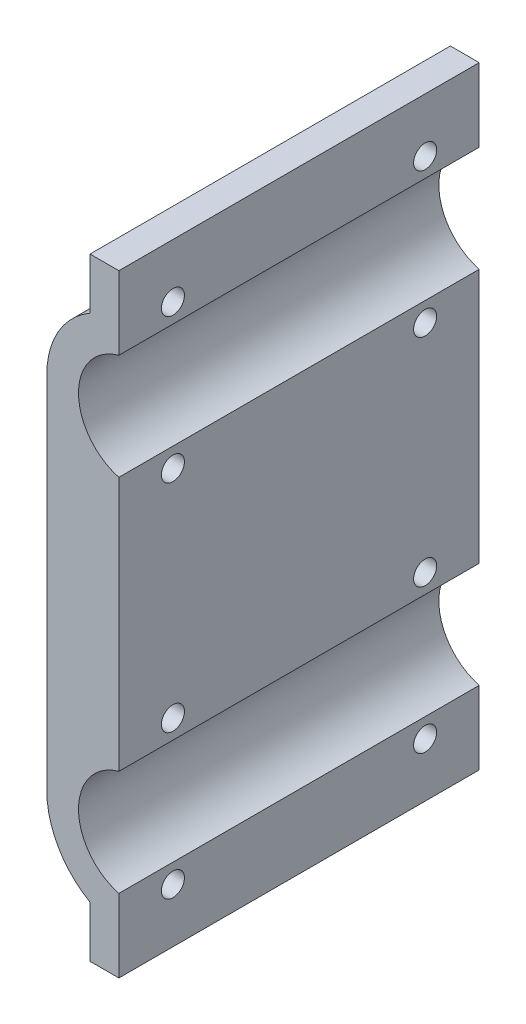
from build123d import *

# Parameters (mm, degrees)
RESSALTO_EXTRUS_O1_DEPTH        = 50
ESBO_O2_R                       = 1.6
CORTE_EXTRUS_O1_DEPTH           = 67.379590237
CORTE_EXTRUS_O2_DEPTH           = 6
CORTE_EXTRUS_O2_DRAFT           = -2
CORTE_EXTRUS_O2_PROFILE_2_DEPTH = 6
CORTE_EXTRUS_O2_PROFILE_2_DRAFT = -2
CORTE_EXTRUS_O2_PROFILE_3_DEPTH = 6
CORTE_EXTRUS_O2_PROFILE_3_DRAFT = -2
CORTE_EXTRUS_O2_PROFILE_4_DEPTH = 6
CORTE_EXTRUS_O2_PROFILE_4_DRAFT = -2
CORTE_EXTRUS_O2_PROFILE_5_DEPTH = 6
CORTE_EXTRUS_O2_PROFILE_5_DRAFT = -2
CORTE_EXTRUS_O2_PROFILE_6_DEPTH = 6
CORTE_EXTRUS_O2_PROFILE_6_DRAFT = -2
CORTE_EXTRUS_O2_PROFILE_7_DEPTH = 6
CORTE_EXTRUS_O2_PROFILE_7_DRAFT = -2
CORTE_EXTRUS_O2_PROFILE_8_DEPTH = 6
CORTE_EXTRUS_O2_PROFILE_8_DRAFT = -2


with BuildPart() as part:
    # Esboço1 → Ressalto-extrusão1 (new body)
    with BuildSketch(Plane.XY):
        with BuildLine():
            Line((0, 17.667878888), (0, -17.667878888))
            ThreePointArc((0, -17.667878888), (-5.6, -25), (0, -32.332121112))
            Line((0, -32.332121112), (0, -42.5))
            Line((0, -42.5), (-4, -42.5))
            Line((-4, -42.5), (-4, -35.392304845))
            ThreePointArc((-4, -35.392304845), (-8.392304845, -31), (-10, -25))
            Line((-10, -25), (-10, 25))
            ThreePointArc((-10, 25), (-8.392304845, 31), (-4, 35.392304845))
            Line((-4, 35.392304845), (-4, 42.5))
            Line((-4, 42.5), (0, 42.5))
            Line((0, 42.5), (0, 32.332121112))
            ThreePointArc((0, 32.332121112), (-5.6, 25), (0, 17.667878888))
        make_face()
    extrude(amount=RESSALTO_EXTRUS_O1_DEPTH)

    # Esboço2 → Corte-extrusão1 (cut, through all)
    with BuildSketch(Plane(origin=(0, 0, 0), x_dir=(0, 0, -1), z_dir=(1, 0, 0))):
        with Locations(Location((-42.5, 35, 0), (0, 0, 90))):
            Circle(ESBO_O2_R)
        with Locations(Location((-7.5, 35, 0), (0, 0, 90))):
            Circle(ESBO_O2_R)
        with Locations(Location((-7.5, -35, 0), (0, 0, 90))):
            Circle(ESBO_O2_R)
        with Locations(Location((-42.5, -35, 0), (0, 0, 90))):
            Circle(ESBO_O2_R)
        with Locations(Location((-42.5, -15, 0), (0, 0, 90))):
            Circle(ESBO_O2_R)
        with Locations(Location((-42.5, 15, 0), (0, 0, 90))):
            Circle(ESBO_O2_R)
        with Locations(Location((-7.5, 15, 0), (0, 0, 90))):
            Circle(ESBO_O2_R)
        with Locations(Location((-7.5, -15, 0), (0, 0, 90))):
            Circle(ESBO_O2_R)
    extrude(amount=-CORTE_EXTRUS_O1_DEPTH, mode=Mode.SUBTRACT)


with BuildPart() as corte_extrus_o2_tool:
    # Esboço3 → Corte-extrusão2 (with draft: the straight prism first)
    with BuildSketch(Plane.ZY.offset(10)):
        Polygon((10.25, 36.58771324), (7.5, 38.175426481), (4.75, 36.58771324), (4.75, 33.41228676), (7.5, 31.824573519), (10.25, 33.41228676), align=None)
    extrude(amount=-CORTE_EXTRUS_O2_DEPTH)
    # Corte-extrusão2: the draft: its side faces are tilted about the plane it starts from
    corte_extrus_o2_sides = [corte_extrus_o2_tool.faces().sort_by_distance(p)[0] for p in [
        (-7, 37.38156986, 8.875),
        (-7, 37.38156986, 6.125),
        (-7, 35, 4.75),
        (-7, 32.61843014, 6.125),
        (-7, 32.61843014, 8.875),
        (-7, 35, 10.25),
    ]]
    draft(corte_extrus_o2_sides, Plane.ZY.offset(10), CORTE_EXTRUS_O2_DRAFT)


with BuildPart() as part_1:
    add(part.part)

    # Corte-extrusão2: cut by corte_extrus_o2_tool
    add(corte_extrus_o2_tool.part, mode=Mode.SUBTRACT)


with BuildPart() as corte_extrus_o2_profile_2_tool:
    # Esboço3 → Corte-extrusão2 profile 2 (with draft: the straight prism first)
    with BuildSketch(Plane.ZY.offset(10)):
        Polygon((45.25, 36.58771324), (42.5, 38.175426481), (39.75, 36.58771324), (39.75, 33.41228676), (42.5, 31.824573519), (45.25, 33.41228676), align=None)
    extrude(amount=-CORTE_EXTRUS_O2_PROFILE_2_DEPTH)
    # Corte-extrusão2 profile 2: the draft: its side faces are tilted about the plane it starts from
    corte_extrus_o2_profile_2_sides = [corte_extrus_o2_profile_2_tool.faces().sort_by_distance(p)[0] for p in [
        (-7, 37.38156986, 43.875),
        (-7, 37.38156986, 41.125),
        (-7, 35, 39.75),
        (-7, 32.61843014, 41.125),
        (-7, 32.61843014, 43.875),
        (-7, 35, 45.25),
    ]]
    draft(corte_extrus_o2_profile_2_sides, Plane.ZY.offset(10), CORTE_EXTRUS_O2_PROFILE_2_DRAFT)


with BuildPart() as part_2:
    add(part_1.part)

    # Corte-extrusão2 profile 2: cut by corte_extrus_o2_profile_2_tool
    add(corte_extrus_o2_profile_2_tool.part, mode=Mode.SUBTRACT)


with BuildPart() as corte_extrus_o2_profile_3_tool:
    # Esboço3 → Corte-extrusão2 profile 3 (with draft: the straight prism first)
    with BuildSketch(Plane.ZY.offset(10)):
        Polygon((45.25, 16.58771324), (42.5, 18.175426481), (39.75, 16.58771324), (39.75, 13.41228676), (42.5, 11.824573519), (45.25, 13.41228676), align=None)
    extrude(amount=-CORTE_EXTRUS_O2_PROFILE_3_DEPTH)
    # Corte-extrusão2 profile 3: the draft: its side faces are tilted about the plane it starts from
    corte_extrus_o2_profile_3_sides = [corte_extrus_o2_profile_3_tool.faces().sort_by_distance(p)[0] for p in [
        (-7, 17.38156986, 43.875),
        (-7, 17.38156986, 41.125),
        (-7, 15, 39.75),
        (-7, 12.61843014, 41.125),
        (-7, 12.61843014, 43.875),
        (-7, 15, 45.25),
    ]]
    draft(corte_extrus_o2_profile_3_sides, Plane.ZY.offset(10), CORTE_EXTRUS_O2_PROFILE_3_DRAFT)


with BuildPart() as part_3:
    add(part_2.part)

    # Corte-extrusão2 profile 3: cut by corte_extrus_o2_profile_3_tool
    add(corte_extrus_o2_profile_3_tool.part, mode=Mode.SUBTRACT)


with BuildPart() as corte_extrus_o2_profile_4_tool:
    # Esboço3 → Corte-extrusão2 profile 4 (with draft: the straight prism first)
    with BuildSketch(Plane.ZY.offset(10)):
        Polygon((10.25, 16.58771324), (7.5, 18.175426481), (4.75, 16.58771324), (4.75, 13.41228676), (7.5, 11.824573519), (10.25, 13.41228676), align=None)
    extrude(amount=-CORTE_EXTRUS_O2_PROFILE_4_DEPTH)
    # Corte-extrusão2 profile 4: the draft: its side faces are tilted about the plane it starts from
    corte_extrus_o2_profile_4_sides = [corte_extrus_o2_profile_4_tool.faces().sort_by_distance(p)[0] for p in [
        (-7, 17.38156986, 8.875),
        (-7, 17.38156986, 6.125),
        (-7, 15, 4.75),
        (-7, 12.61843014, 6.125),
        (-7, 12.61843014, 8.875),
        (-7, 15, 10.25),
    ]]
    draft(corte_extrus_o2_profile_4_sides, Plane.ZY.offset(10), CORTE_EXTRUS_O2_PROFILE_4_DRAFT)


with BuildPart() as part_4:
    add(part_3.part)

    # Corte-extrusão2 profile 4: cut by corte_extrus_o2_profile_4_tool
    add(corte_extrus_o2_profile_4_tool.part, mode=Mode.SUBTRACT)


with BuildPart() as corte_extrus_o2_profile_5_tool:
    # Esboço3 → Corte-extrusão2 profile 5 (with draft: the straight prism first)
    with BuildSketch(Plane.ZY.offset(10)):
        Polygon((10.25, -13.41228676), (7.5, -11.824573519), (4.75, -13.41228676), (4.75, -16.58771324), (7.5, -18.175426481), (10.25, -16.58771324), align=None)
    extrude(amount=-CORTE_EXTRUS_O2_PROFILE_5_DEPTH)
    # Corte-extrusão2 profile 5: the draft: its side faces are tilted about the plane it starts from
    corte_extrus_o2_profile_5_sides = [corte_extrus_o2_profile_5_tool.faces().sort_by_distance(p)[0] for p in [
        (-7, -12.61843014, 8.875),
        (-7, -12.61843014, 6.125),
        (-7, -15, 4.75),
        (-7, -17.38156986, 6.125),
        (-7, -17.38156986, 8.875),
        (-7, -15, 10.25),
    ]]
    draft(corte_extrus_o2_profile_5_sides, Plane.ZY.offset(10), CORTE_EXTRUS_O2_PROFILE_5_DRAFT)


with BuildPart() as part_5:
    add(part_4.part)

    # Corte-extrusão2 profile 5: cut by corte_extrus_o2_profile_5_tool
    add(corte_extrus_o2_profile_5_tool.part, mode=Mode.SUBTRACT)


with BuildPart() as corte_extrus_o2_profile_6_tool:
    # Esboço3 → Corte-extrusão2 profile 6 (with draft: the straight prism first)
    with BuildSketch(Plane.ZY.offset(10)):
        Polygon((10.25, -33.41228676), (7.5, -31.824573519), (4.75, -33.41228676), (4.75, -36.58771324), (7.5, -38.175426481), (10.25, -36.58771324), align=None)
    extrude(amount=-CORTE_EXTRUS_O2_PROFILE_6_DEPTH)
    # Corte-extrusão2 profile 6: the draft: its side faces are tilted about the plane it starts from
    corte_extrus_o2_profile_6_sides = [corte_extrus_o2_profile_6_tool.faces().sort_by_distance(p)[0] for p in [
        (-7, -32.61843014, 8.875),
        (-7, -32.61843014, 6.125),
        (-7, -35, 4.75),
        (-7, -37.38156986, 6.125),
        (-7, -37.38156986, 8.875),
        (-7, -35, 10.25),
    ]]
    draft(corte_extrus_o2_profile_6_sides, Plane.ZY.offset(10), CORTE_EXTRUS_O2_PROFILE_6_DRAFT)


with BuildPart() as part_6:
    add(part_5.part)

    # Corte-extrusão2 profile 6: cut by corte_extrus_o2_profile_6_tool
    add(corte_extrus_o2_profile_6_tool.part, mode=Mode.SUBTRACT)


with BuildPart() as corte_extrus_o2_profile_7_tool:
    # Esboço3 → Corte-extrusão2 profile 7 (with draft: the straight prism first)
    with BuildSketch(Plane.ZY.offset(10)):
        Polygon((45.25, -33.41228676), (42.5, -31.824573519), (39.75, -33.41228676), (39.75, -36.58771324), (42.5, -38.175426481), (45.25, -36.58771324), align=None)
    extrude(amount=-CORTE_EXTRUS_O2_PROFILE_7_DEPTH)
    # Corte-extrusão2 profile 7: the draft: its side faces are tilted about the plane it starts from
    corte_extrus_o2_profile_7_sides = [corte_extrus_o2_profile_7_tool.faces().sort_by_distance(p)[0] for p in [
        (-7, -32.61843014, 43.875),
        (-7, -32.61843014, 41.125),
        (-7, -35, 39.75),
        (-7, -37.38156986, 41.125),
        (-7, -37.38156986, 43.875),
        (-7, -35, 45.25),
    ]]
    draft(corte_extrus_o2_profile_7_sides, Plane.ZY.offset(10), CORTE_EXTRUS_O2_PROFILE_7_DRAFT)


with BuildPart() as part_7:
    add(part_6.part)

    # Corte-extrusão2 profile 7: cut by corte_extrus_o2_profile_7_tool
    add(corte_extrus_o2_profile_7_tool.part, mode=Mode.SUBTRACT)


with BuildPart() as corte_extrus_o2_profile_8_tool:
    # Esboço3 → Corte-extrusão2 profile 8 (with draft: the straight prism first)
    with BuildSketch(Plane.ZY.offset(10)):
        Polygon((45.25, -13.41228676), (42.5, -11.824573519), (39.75, -13.41228676), (39.75, -16.58771324), (42.5, -18.175426481), (45.25, -16.58771324), align=None)
    extrude(amount=-CORTE_EXTRUS_O2_PROFILE_8_DEPTH)
    # Corte-extrusão2 profile 8: the draft: its side faces are tilted about the plane it starts from
    corte_extrus_o2_profile_8_sides = [corte_extrus_o2_profile_8_tool.faces().sort_by_distance(p)[0] for p in [
        (-7, -12.61843014, 43.875),
        (-7, -12.61843014, 41.125),
        (-7, -15, 39.75),
        (-7, -17.38156986, 41.125),
        (-7, -17.38156986, 43.875),
        (-7, -15, 45.25),
    ]]
    draft(corte_extrus_o2_profile_8_sides, Plane.ZY.offset(10), CORTE_EXTRUS_O2_PROFILE_8_DRAFT)


with BuildPart() as part_8:
    add(part_7.part)

    # Corte-extrusão2 profile 8: cut by corte_extrus_o2_profile_8_tool
    add(corte_extrus_o2_profile_8_tool.part, mode=Mode.SUBTRACT)


solid = part_8.part
